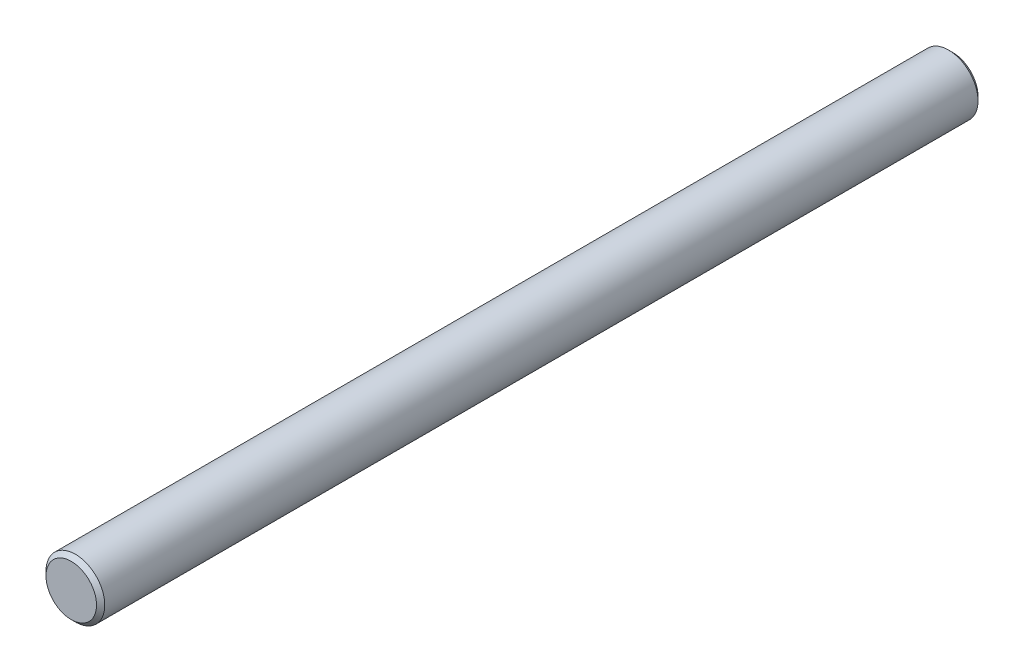
from build123d import *

# Parameters (mm, degrees)
BOSS_EXTRUDE1_DEPTH      = 60
BOSS_EXTRUDE1_DEPTH_BACK = 60
SKETCH3_R                = 4
CHAMFER1_SIZE            = 0.56


with BuildPart() as part:
    # Sketch3 → Boss-Extrude1 (new, two sides: drawn at the far end of the back side and taken through both)
    with BuildSketch(Plane.XY.offset(-BOSS_EXTRUDE1_DEPTH_BACK)):
        Circle(SKETCH3_R)
    extrude(amount=BOSS_EXTRUDE1_DEPTH + BOSS_EXTRUDE1_DEPTH_BACK)

    # Chamfer1
    chamfer1_edges = [part.edges().sort_by_distance(p)[0] for p in [
        (-4, 0, -60),
        (-4, 0, 60),
    ]]
    chamfer(chamfer1_edges, length=CHAMFER1_SIZE)


solid = part.part
